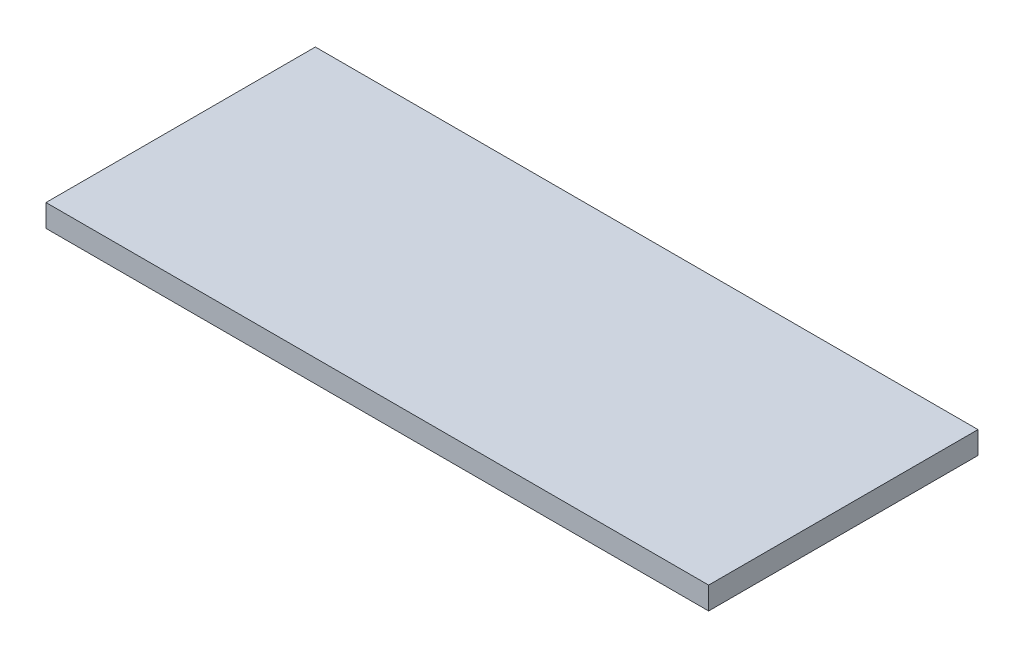
from build123d import *

# Parameters (mm, degrees)
SKETCH1_W           = 187.452
SKETCH1_H           = 76.2
BOSS_EXTRUDE1_DEPTH = 6.35


with BuildPart() as part:
    # Sketch1 → Boss-Extrude1 (new body)
    with BuildSketch(Plane(origin=(0, 0, 0), x_dir=(1, 0, 0), z_dir=(0, 1, 0))):
        Rectangle(SKETCH1_W, SKETCH1_H)
    extrude(amount=BOSS_EXTRUDE1_DEPTH)


solid = part.part
